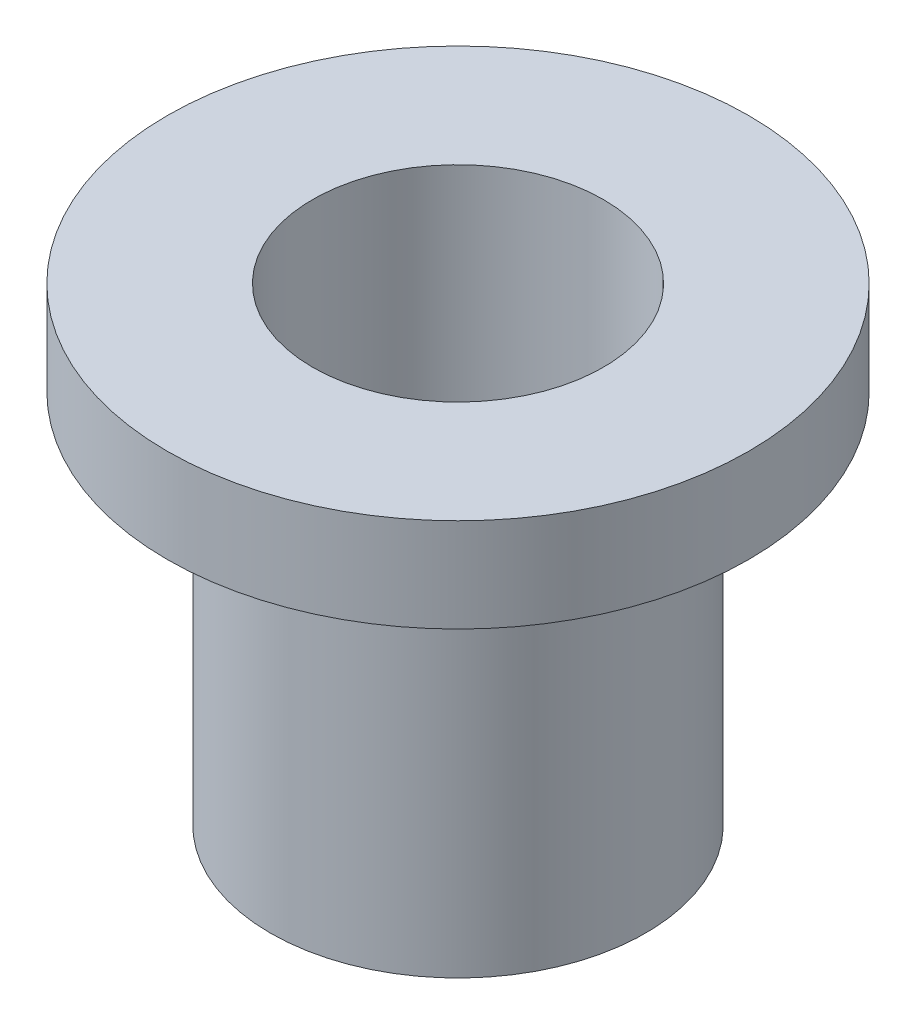
from build123d import *


with BuildPart() as part:
    # Sketch1 → Revolve1 (revolve)
    with BuildSketch(Plane(origin=(0, 0, 0), x_dir=(0, 0, -1), z_dir=(1, 0, 0)), mode=Mode.PRIVATE) as revolve1_sk:
        Polygon((1.55, 2.5), (3.1, 2.5), (3.1, 1.5), (2, 1.5), (2, -2.5), (1.55, -2.5), align=None)
    revolve(revolve1_sk.sketch.rotate(Axis((0, 8.761716621, 0), (0, -1, 0)), 180), axis=Axis((0, 8.761716621, 0), (0, -1, 0)))


solid = part.part
